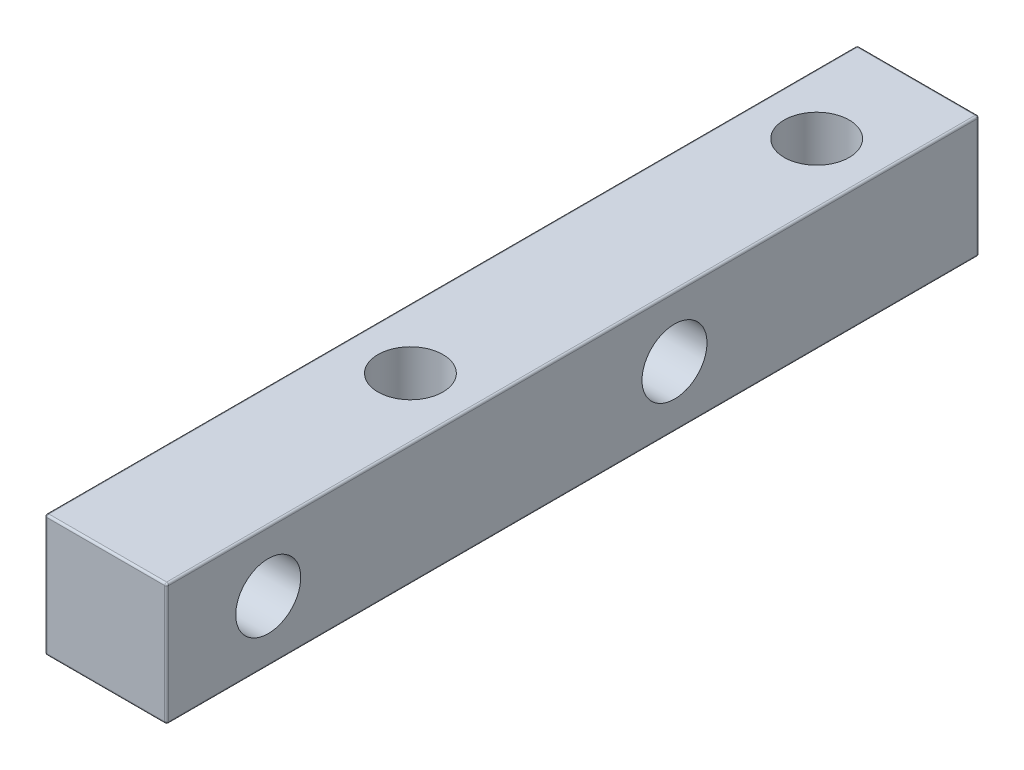
from build123d import *

# Parameters (mm, degrees)
SKETCH_1_W          = 6
SKETCH_1_H          = 6
EXTRUDE_1_DEPTH     = 40
SKETCH_2_R          = 1.6
CUT_EXTRUDE_1_DEPTH = 40
SKETCH_3_R          = 1.6
CUT_EXTRUDE_2_DEPTH = 40
FILLET_1_R          = 0.1


with BuildPart() as part:
    # 草图1 → 凸台-拉伸1 (new body)
    with BuildSketch(Plane.XY):
        Rectangle(SKETCH_1_W, SKETCH_1_H)
    extrude(amount=EXTRUDE_1_DEPTH)

    # 草图2 → 切除-拉伸1 (cut)
    with BuildSketch(Plane.ZY.offset(3)):
        with Locations(Location((15, 0, 0), (0, 0, 270))):
            Circle(SKETCH_2_R)
        with Locations(Location((35, 0, 0), (0, 0, 270))):
            Circle(SKETCH_2_R)
    extrude(amount=-CUT_EXTRUDE_1_DEPTH, mode=Mode.SUBTRACT)

    # 草图3 → 切除-拉伸2 (cut)
    with BuildSketch(Plane(origin=(0, 3, 0), x_dir=(1, 0, 0), z_dir=(0, 1, 0))):
        with Locations(Location((0, -5, 0), (0, 0, 270))):
            Circle(SKETCH_3_R)
        with Locations(Location((0, -25, 0), (0, 0, 270))):
            Circle(SKETCH_3_R)
    extrude(amount=-CUT_EXTRUDE_2_DEPTH, mode=Mode.SUBTRACT)

    # 圆角1
    fillet_1_edges = [part.edges().sort_by_distance(p)[0] for p in [
        (-3, 0, 40),
        (0, -3, 40),
        (3, 0, 40),
        (0, -3, 0),
        (-3, 0, 0),
        (0, 3, 0),
        (3, 0, 0),
        (3, -3, 20),
        (-3, -3, 20),
        (-3, 3, 20),
        (3, 3, 20),
        (0, 3, 40),
    ]]
    fillet(fillet_1_edges, radius=FILLET_1_R)


solid = part.part
